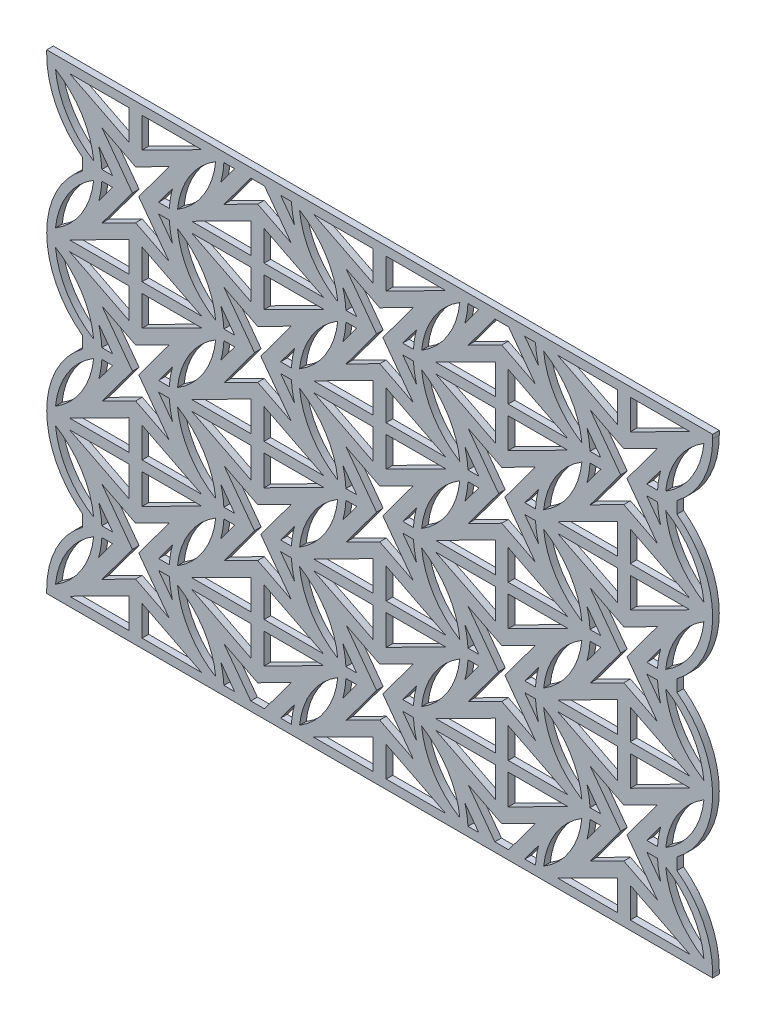
from build123d import *

# Parameters (mm, degrees)
BOSS_EXTRUDE2_DEPTH = 1.2


with BuildPart() as part:
    # Sketch1 → Boss-Extrude2 (new body)
    with BuildSketch(Plane.XY):
        with BuildLine():
            Line((-17.282218506, -13.133720362), (-17.282218506, -13.850172014))
            Line((-17.282218506, -13.850172014), (14.917781494, -13.850172014))
            Line((14.917781494, -13.850172014), (26.932678434, -13.850172014))
            Line((26.932678434, -13.850172014), (59.132678434, -13.850172014))
            Line((59.132678434, -13.850172014), (71.147575375, -13.850172014))
            Line((71.147575375, -13.850172014), (103.347575375, -13.850172014))
            Line((103.347575375, -13.850172014), (103.347575375, -13.133720362))
            ThreePointArc((103.347575375, -13.133720362), (101.64184858, -5.921584832), (96.88609725, -0.237639715))
            Line((96.88609725, -0.237639715), (96.88609725, 1.922478065))
            ThreePointArc((96.88609725, 1.922478065), (101.64184858, 7.606423182), (103.347575375, 14.818558712))
            ThreePointArc((103.347575375, 14.818558712), (101.64184858, 22.030694242), (96.88609725, 27.714639359))
            Line((96.88609725, 27.714639359), (96.88609725, 29.874757139))
            ThreePointArc((96.88609725, 29.874757139), (101.64184858, 35.558702256), (103.347575375, 42.770837786))
            ThreePointArc((103.347575375, 42.770837786), (101.64184858, 49.982973316), (96.88609725, 55.666918433))
            Line((96.88609725, 55.666918433), (96.88609725, 57.827036212))
            ThreePointArc((96.88609725, 57.827036212), (101.64184858, 63.51098133), (103.347575375, 70.723116859))
            Line((103.347575375, 70.723116859), (103.347575375, 71.439568512))
            Line((103.347575375, 71.439568512), (71.147575375, 71.439568512))
            Line((71.147575375, 71.439568512), (59.132678434, 71.439568512))
            Line((59.132678434, 71.439568512), (26.932678434, 71.439568512))
            Line((26.932678434, 71.439568512), (14.917781494, 71.439568512))
            Line((14.917781494, 71.439568512), (-17.282218506, 71.439568512))
            Line((-17.282218506, 71.439568512), (-17.282218506, 70.723116859))
            ThreePointArc((-17.282218506, 70.723116859), (-15.576491711, 63.51098133), (-10.820740382, 57.827036212))
            Line((-10.820740382, 57.827036212), (-10.820740382, 55.666918433))
            ThreePointArc((-10.820740382, 55.666918433), (-15.576491711, 49.982973316), (-17.282218506, 42.770837786))
            ThreePointArc((-17.282218506, 42.770837786), (-15.576491711, 35.558702256), (-10.820740382, 29.874757139))
            Line((-10.820740382, 29.874757139), (-10.820740382, 27.714639359))
            ThreePointArc((-10.820740382, 27.714639359), (-15.576491711, 22.030694242), (-17.282218506, 14.818558712))
            ThreePointArc((-17.282218506, 14.818558712), (-15.576491711, 7.606423182), (-10.820740382, 1.922478065))
            Line((-10.820740382, 1.922478065), (-10.820740382, -0.237639715))
            ThreePointArc((-10.820740382, -0.237639715), (-15.576491711, -5.921584832), (-17.282218506, -13.133720362))
        make_face()
        with BuildLine():
            Line((2.983915583, -0.076112846), (4.93282341, -0.076112846))
            ThreePointArc((4.93282341, -0.076112846), (5.124211725, -1.789802525), (5.498694363, -3.47299133))
            Line((5.498694363, -3.47299133), (2.983915583, -0.076112846))
        make_face(mode=Mode.SUBTRACT)
        with BuildLine():
            Line((-5.348352595, -0.076112846), (-7.297260422, -0.076112846))
            ThreePointArc((-7.297260422, -0.076112846), (-7.488648737, -1.789802525), (-7.863131375, -3.47299133))
            Line((-7.863131375, -3.47299133), (-5.348352595, -0.076112846))
        make_face(mode=Mode.SUBTRACT)
        with BuildLine():
            Line((-5.348352595, 1.760951197), (-7.863131375, 5.15782968))
            ThreePointArc((-7.863131375, 5.15782968), (-7.488648737, 3.474640875), (-7.297260422, 1.760951197))
            Line((-7.297260422, 1.760951197), (-5.348352595, 1.760951197))
        make_face(mode=Mode.SUBTRACT)
        Polygon((10.781824584, 13.90002669), (-0.008778726, 13.90002669), (-0.008778726, 8.450081975), align=None, mode=Mode.SUBTRACT)
        with BuildLine():
            Line((2.983915583, 1.760951197), (5.498694363, 5.15782968))
            ThreePointArc((5.498694363, 5.15782968), (5.124211725, 3.474640875), (4.93282341, 1.760951197))
            Line((4.93282341, 1.760951197), (2.983915583, 1.760951197))
        make_face(mode=Mode.SUBTRACT)
        Polygon((-2.355658286, 8.450081975), (-13.146261597, 13.90002669), (-2.355658286, 13.90002669), align=None, mode=Mode.SUBTRACT)
        Polygon((-1.182218506, -3.543353993), (4.907916872, -6.619261814), (-0.616118535, 0.842419175), (4.907916872, 8.304100164), (-1.182218506, 5.228192343), (-7.272353885, 8.304100164), (-1.748318477, 0.842419175), (-7.272353885, -6.619261814), align=None, mode=Mode.SUBTRACT)
        Polygon((-0.008778726, -12.21518834), (-0.008778726, -6.765243625), (10.781824584, -12.21518834), align=None, mode=Mode.SUBTRACT)
        Polygon((-2.355658286, -12.21518834), (-2.355658286, -6.765243625), (-13.146261597, -12.21518834), align=None, mode=Mode.SUBTRACT)
        Polygon((32.889273055, 27.876166227), (22.098669744, 27.876166227), (22.098669744, 22.426221512), align=None, mode=Mode.SUBTRACT)
        Polygon((32.889273055, 1.760951197), (22.098669744, 1.760951197), (22.098669744, 7.210895912), align=None, mode=Mode.SUBTRACT)
        Polygon((19.751790184, 27.876166227), (8.961186874, 27.876166227), (19.751790184, 22.426221512), align=None, mode=Mode.SUBTRACT)
        with BuildLine():
            Line((16.759095875, 13.90002669), (14.244317095, 10.503148207))
            ThreePointArc((14.244317095, 10.503148207), (14.618799733, 12.186337012), (14.810188048, 13.90002669))
            Line((14.810188048, 13.90002669), (16.759095875, 13.90002669))
        make_face(mode=Mode.SUBTRACT)
        with BuildLine():
            Line((16.759095875, 15.737090733), (14.810188048, 15.737090733))
            ThreePointArc((14.810188048, 15.737090733), (14.618799733, 17.450780412), (14.244317095, 19.133969217))
            Line((14.244317095, 19.133969217), (16.759095875, 15.737090733))
        make_face(mode=Mode.SUBTRACT)
        Polygon((19.751790184, 1.760951197), (8.961186874, 1.760951197), (19.751790184, 7.210895912), align=None, mode=Mode.SUBTRACT)
        Polygon((20.925229964, 19.20433188), (27.015365342, 22.280239701), (21.491329935, 14.818558712), (27.015365342, 7.356877723), (20.925229964, 10.432785544), (14.835094586, 7.356877723), (20.359129993, 14.818558712), (14.835094586, 22.280239701), align=None, mode=Mode.SUBTRACT)
        with BuildLine():
            Line((25.091364053, 15.737090733), (27.04027188, 15.737090733))
            ThreePointArc((27.04027188, 15.737090733), (27.231660195, 17.450780412), (27.606142833, 19.133969217))
            Line((27.606142833, 19.133969217), (25.091364053, 15.737090733))
        make_face(mode=Mode.SUBTRACT)
        with BuildLine():
            Line((25.091364053, 13.90002669), (27.606142833, 10.503148207))
            ThreePointArc((27.606142833, 10.503148207), (27.231660195, 12.186337012), (27.04027188, 13.90002669))
            Line((27.04027188, 13.90002669), (25.091364053, 13.90002669))
        make_face(mode=Mode.SUBTRACT)
        Polygon((54.996721525, 41.852305764), (44.206118214, 41.852305764), (44.206118214, 36.402361049), align=None, mode=Mode.SUBTRACT)
        Polygon((54.996721525, 15.737090733), (44.206118214, 15.737090733), (44.206118214, 21.187035449), align=None, mode=Mode.SUBTRACT)
        Polygon((41.859238654, 41.852305764), (31.068635344, 41.852305764), (41.859238654, 36.402361049), align=None, mode=Mode.SUBTRACT)
        with BuildLine():
            Line((38.866544345, 27.876166227), (36.351765565, 24.479287744))
            ThreePointArc((36.351765565, 24.479287744), (36.726248203, 26.162476549), (36.917636519, 27.876166227))
            Line((36.917636519, 27.876166227), (38.866544345, 27.876166227))
        make_face(mode=Mode.SUBTRACT)
        with BuildLine():
            Line((38.866544345, 29.71323027), (36.917636519, 29.71323027))
            ThreePointArc((36.917636519, 29.71323027), (36.726248203, 31.426919948), (36.351765565, 33.110108754))
            Line((36.351765565, 33.110108754), (38.866544345, 29.71323027))
        make_face(mode=Mode.SUBTRACT)
        Polygon((41.859238654, 15.737090733), (31.068635344, 15.737090733), (41.859238654, 21.187035449), align=None, mode=Mode.SUBTRACT)
        Polygon((43.032678434, 33.180471417), (49.122813813, 36.256379238), (43.598778405, 28.794698249), (49.122813813, 21.333017259), (43.032678434, 24.408925081), (36.942543056, 21.333017259), (42.466578463, 28.794698249), (36.942543056, 36.256379238), align=None, mode=Mode.SUBTRACT)
        with BuildLine():
            Line((47.198812523, 29.71323027), (49.14772035, 29.71323027))
            ThreePointArc((49.14772035, 29.71323027), (49.339108665, 31.426919948), (49.713591303, 33.110108754))
            Line((49.713591303, 33.110108754), (47.198812523, 29.71323027))
        make_face(mode=Mode.SUBTRACT)
        with BuildLine():
            Line((47.198812523, 27.876166227), (49.713591303, 24.479287744))
            ThreePointArc((49.713591303, 24.479287744), (49.339108665, 26.162476549), (49.14772035, 27.876166227))
            Line((49.14772035, 27.876166227), (47.198812523, 27.876166227))
        make_face(mode=Mode.SUBTRACT)
        Polygon((77.104169995, 55.828445301), (66.313566685, 55.828445301), (66.313566685, 50.378500585), align=None, mode=Mode.SUBTRACT)
        Polygon((77.104169995, 29.71323027), (66.313566685, 29.71323027), (66.313566685, 35.163174986), align=None, mode=Mode.SUBTRACT)
        Polygon((63.966687125, 55.828445301), (53.176083814, 55.828445301), (63.966687125, 50.378500585), align=None, mode=Mode.SUBTRACT)
        with BuildLine():
            Line((60.973992816, 41.852305764), (58.459214035, 38.455427281))
            ThreePointArc((58.459214035, 38.455427281), (58.833696674, 40.138616086), (59.025084989, 41.852305764))
            Line((59.025084989, 41.852305764), (60.973992816, 41.852305764))
        make_face(mode=Mode.SUBTRACT)
        with BuildLine():
            Line((60.973992816, 43.689369807), (59.025084989, 43.689369807))
            ThreePointArc((59.025084989, 43.689369807), (58.833696674, 45.403059485), (58.459214035, 47.08624829))
            Line((58.459214035, 47.08624829), (60.973992816, 43.689369807))
        make_face(mode=Mode.SUBTRACT)
        Polygon((63.966687125, 29.71323027), (53.176083814, 29.71323027), (63.966687125, 35.163174986), align=None, mode=Mode.SUBTRACT)
        Polygon((65.140126905, 47.156610953), (71.230262283, 50.232518775), (65.706226876, 42.770837786), (71.230262283, 35.309156796), (65.140126905, 38.385064618), (59.049991526, 35.309156796), (64.574026933, 42.770837786), (59.049991526, 50.232518775), align=None, mode=Mode.SUBTRACT)
        with BuildLine():
            Line((69.306260993, 43.689369807), (71.25516882, 43.689369807))
            ThreePointArc((71.25516882, 43.689369807), (71.446557135, 45.403059485), (71.821039774, 47.08624829))
            Line((71.821039774, 47.08624829), (69.306260993, 43.689369807))
        make_face(mode=Mode.SUBTRACT)
        with BuildLine():
            Line((69.306260993, 41.852305764), (71.821039774, 38.455427281))
            ThreePointArc((71.821039774, 38.455427281), (71.446557135, 40.138616086), (71.25516882, 41.852305764))
            Line((71.25516882, 41.852305764), (69.306260993, 41.852305764))
        make_face(mode=Mode.SUBTRACT)
        Polygon((99.211618465, 69.804584838), (88.421015155, 69.804584838), (88.421015155, 64.354640122), align=None, mode=Mode.SUBTRACT)
        Polygon((99.211618465, 43.689369807), (88.421015155, 43.689369807), (88.421015155, 49.139314523), align=None, mode=Mode.SUBTRACT)
        Polygon((86.074135595, 69.804584838), (75.283532284, 69.804584838), (86.074135595, 64.354640122), align=None, mode=Mode.SUBTRACT)
        with BuildLine():
            Line((83.081441286, 55.828445301), (80.566662506, 52.431566818))
            ThreePointArc((80.566662506, 52.431566818), (80.941145144, 54.114755623), (81.132533459, 55.828445301))
            Line((81.132533459, 55.828445301), (83.081441286, 55.828445301))
        make_face(mode=Mode.SUBTRACT)
        with BuildLine():
            Line((83.081441286, 57.665509344), (81.132533459, 57.665509344))
            ThreePointArc((81.132533459, 57.665509344), (80.941145144, 59.379199022), (80.566662506, 61.062387827))
            Line((80.566662506, 61.062387827), (83.081441286, 57.665509344))
        make_face(mode=Mode.SUBTRACT)
        Polygon((86.074135595, 43.689369807), (75.283532284, 43.689369807), (86.074135595, 49.139314523), align=None, mode=Mode.SUBTRACT)
        Polygon((87.247575375, 61.13275049), (93.337710753, 64.208658312), (87.813675346, 56.746977323), (93.337710753, 49.285296333), (87.247575375, 52.361204155), (81.157439996, 49.285296333), (86.681475404, 56.746977323), (81.157439996, 64.208658312), align=None, mode=Mode.SUBTRACT)
        with BuildLine():
            Line((91.413709464, 57.665509344), (93.362617291, 57.665509344))
            ThreePointArc((93.362617291, 57.665509344), (93.554005606, 59.379199022), (93.928488244, 61.062387827))
            Line((93.928488244, 61.062387827), (91.413709464, 57.665509344))
        make_face(mode=Mode.SUBTRACT)
        with BuildLine():
            Line((91.413709464, 55.828445301), (93.928488244, 52.431566818))
            ThreePointArc((93.928488244, 52.431566818), (93.554005606, 54.114755623), (93.362617291, 55.828445301))
            Line((93.362617291, 55.828445301), (91.413709464, 55.828445301))
        make_face(mode=Mode.SUBTRACT)
        Polygon((20.925229964, 47.156610953), (27.015365342, 50.232518775), (21.491329935, 42.770837786), (27.015365342, 35.309156796), (20.925229964, 38.385064618), (14.835094586, 35.309156796), (20.359129993, 42.770837786), (14.835094586, 50.232518775), align=None, mode=Mode.SUBTRACT)
        with BuildLine():
            Line((16.759095875, 41.852305764), (14.244317095, 38.455427281))
            ThreePointArc((14.244317095, 38.455427281), (14.618799733, 40.138616086), (14.810188048, 41.852305764))
            Line((14.810188048, 41.852305764), (16.759095875, 41.852305764))
        make_face(mode=Mode.SUBTRACT)
        with BuildLine():
            Line((25.091364053, 41.852305764), (27.04027188, 41.852305764))
            ThreePointArc((27.04027188, 41.852305764), (27.231660195, 40.138616086), (27.606142833, 38.455427281))
            Line((27.606142833, 38.455427281), (25.091364053, 41.852305764))
        make_face(mode=Mode.SUBTRACT)
        Polygon((19.751790184, 50.378500585), (8.961186874, 55.828445301), (19.751790184, 55.828445301), align=None, mode=Mode.SUBTRACT)
        with BuildLine():
            Line((16.759095875, 43.689369807), (14.244317095, 47.08624829))
            ThreePointArc((14.244317095, 47.08624829), (14.618799733, 45.403059485), (14.810188048, 43.689369807))
            Line((14.810188048, 43.689369807), (16.759095875, 43.689369807))
        make_face(mode=Mode.SUBTRACT)
        Polygon((22.098669744, 29.71323027), (22.098669744, 35.163174986), (32.889273055, 29.71323027), align=None, mode=Mode.SUBTRACT)
        Polygon((22.098669744, 50.378500585), (32.889273055, 55.828445301), (22.098669744, 55.828445301), align=None, mode=Mode.SUBTRACT)
        Polygon((19.751790184, 35.163174986), (8.961186874, 29.71323027), (19.751790184, 29.71323027), align=None, mode=Mode.SUBTRACT)
        with BuildLine():
            Line((25.091364053, 43.689369807), (27.04027188, 43.689369807))
            ThreePointArc((27.04027188, 43.689369807), (27.231660195, 45.403059485), (27.606142833, 47.08624829))
            Line((27.606142833, 47.08624829), (25.091364053, 43.689369807))
        make_face(mode=Mode.SUBTRACT)
        Polygon((43.032678434, 61.13275049), (49.122813813, 64.208658312), (43.598778405, 56.746977323), (49.122813813, 49.285296333), (43.032678434, 52.361204155), (36.942543056, 49.285296333), (42.466578463, 56.746977323), (36.942543056, 64.208658312), align=None, mode=Mode.SUBTRACT)
        with BuildLine():
            Line((38.866544345, 55.828445301), (36.351765565, 52.431566818))
            ThreePointArc((36.351765565, 52.431566818), (36.726248203, 54.114755623), (36.917636519, 55.828445301))
            Line((36.917636519, 55.828445301), (38.866544345, 55.828445301))
        make_face(mode=Mode.SUBTRACT)
        with BuildLine():
            Line((47.198812523, 55.828445301), (49.14772035, 55.828445301))
            ThreePointArc((49.14772035, 55.828445301), (49.339108665, 54.114755623), (49.713591303, 52.431566818))
            Line((49.713591303, 52.431566818), (47.198812523, 55.828445301))
        make_face(mode=Mode.SUBTRACT)
        Polygon((41.859238654, 64.354640122), (31.068635344, 69.804584838), (41.859238654, 69.804584838), align=None, mode=Mode.SUBTRACT)
        with BuildLine():
            Line((38.866544345, 57.665509344), (36.351765565, 61.062387827))
            ThreePointArc((36.351765565, 61.062387827), (36.726248203, 59.379199022), (36.917636519, 57.665509344))
            Line((36.917636519, 57.665509344), (38.866544345, 57.665509344))
        make_face(mode=Mode.SUBTRACT)
        Polygon((44.206118214, 43.689369807), (44.206118214, 49.139314523), (54.996721525, 43.689369807), align=None, mode=Mode.SUBTRACT)
        Polygon((44.206118214, 64.354640122), (54.996721525, 69.804584838), (44.206118214, 69.804584838), align=None, mode=Mode.SUBTRACT)
        Polygon((41.859238654, 49.139314523), (31.068635344, 43.689369807), (41.859238654, 43.689369807), align=None, mode=Mode.SUBTRACT)
        with BuildLine():
            Line((47.198812523, 57.665509344), (49.14772035, 57.665509344))
            ThreePointArc((49.14772035, 57.665509344), (49.339108665, 59.379199022), (49.713591303, 61.062387827))
            Line((49.713591303, 61.062387827), (47.198812523, 57.665509344))
        make_face(mode=Mode.SUBTRACT)
        Polygon((-1.182218506, 33.180471417), (4.907916872, 36.256379238), (-0.616118535, 28.794698249), (4.907916872, 21.333017259), (-1.182218506, 24.408925081), (-7.272353885, 21.333017259), (-1.748318477, 28.794698249), (-7.272353885, 36.256379238), align=None, mode=Mode.SUBTRACT)
        with BuildLine():
            Line((-5.348352595, 27.876166227), (-7.863131375, 24.479287744))
            ThreePointArc((-7.863131375, 24.479287744), (-7.488648737, 26.162476549), (-7.297260422, 27.876166227))
            Line((-7.297260422, 27.876166227), (-5.348352595, 27.876166227))
        make_face(mode=Mode.SUBTRACT)
        with BuildLine():
            Line((2.983915583, 27.876166227), (4.93282341, 27.876166227))
            ThreePointArc((4.93282341, 27.876166227), (5.124211725, 26.162476549), (5.498694363, 24.479287744))
            Line((5.498694363, 24.479287744), (2.983915583, 27.876166227))
        make_face(mode=Mode.SUBTRACT)
        Polygon((-2.355658286, 36.402361049), (-13.146261597, 41.852305764), (-2.355658286, 41.852305764), align=None, mode=Mode.SUBTRACT)
        with BuildLine():
            Line((-5.348352595, 29.71323027), (-7.863131375, 33.110108754))
            ThreePointArc((-7.863131375, 33.110108754), (-7.488648737, 31.426919948), (-7.297260422, 29.71323027))
            Line((-7.297260422, 29.71323027), (-5.348352595, 29.71323027))
        make_face(mode=Mode.SUBTRACT)
        Polygon((-0.008778726, 15.737090733), (-0.008778726, 21.187035449), (10.781824584, 15.737090733), align=None, mode=Mode.SUBTRACT)
        Polygon((-0.008778726, 36.402361049), (10.781824584, 41.852305764), (-0.008778726, 41.852305764), align=None, mode=Mode.SUBTRACT)
        Polygon((-2.355658286, 21.187035449), (-13.146261597, 15.737090733), (-2.355658286, 15.737090733), align=None, mode=Mode.SUBTRACT)
        with BuildLine():
            Line((2.983915583, 29.71323027), (4.93282341, 29.71323027))
            ThreePointArc((4.93282341, 29.71323027), (5.124211725, 31.426919948), (5.498694363, 33.110108754))
            Line((5.498694363, 33.110108754), (2.983915583, 29.71323027))
        make_face(mode=Mode.SUBTRACT)
        with BuildLine():
            Line((60.973992816, 69.804584838), (58.459214035, 66.407706355))
            ThreePointArc((58.459214035, 66.407706355), (58.833696674, 68.09089516), (59.025084989, 69.804584838))
            Line((59.025084989, 69.804584838), (60.973992816, 69.804584838))
        make_face(mode=Mode.SUBTRACT)
        with BuildLine():
            Line((69.306260993, 69.804584838), (71.25516882, 69.804584838))
            ThreePointArc((71.25516882, 69.804584838), (71.446557135, 68.09089516), (71.821039774, 66.407706355))
            Line((71.821039774, 66.407706355), (69.306260993, 69.804584838))
        make_face(mode=Mode.SUBTRACT)
        Polygon((65.140126905, 66.337343692), (71.230262283, 63.26143587), (66.386234962, 69.804584838), (63.894018847, 69.804584838), (59.049991526, 63.26143587), align=None, mode=Mode.SUBTRACT)
        Polygon((66.313566685, 57.665509344), (66.313566685, 63.11545406), (77.104169995, 57.665509344), align=None, mode=Mode.SUBTRACT)
        Polygon((63.966687125, 63.11545406), (53.176083814, 57.665509344), (63.966687125, 57.665509344), align=None, mode=Mode.SUBTRACT)
        with BuildLine():
            Line((16.759095875, 69.804584838), (14.244317095, 66.407706355))
            ThreePointArc((14.244317095, 66.407706355), (14.618799733, 68.09089516), (14.810188048, 69.804584838))
            Line((14.810188048, 69.804584838), (16.759095875, 69.804584838))
        make_face(mode=Mode.SUBTRACT)
        with BuildLine():
            Line((25.091364053, 69.804584838), (27.04027188, 69.804584838))
            ThreePointArc((27.04027188, 69.804584838), (27.231660195, 68.09089516), (27.606142833, 66.407706355))
            Line((27.606142833, 66.407706355), (25.091364053, 69.804584838))
        make_face(mode=Mode.SUBTRACT)
        Polygon((20.925229964, 66.337343692), (27.015365342, 63.26143587), (22.171338021, 69.804584838), (19.679121907, 69.804584838), (14.835094586, 63.26143587), align=None, mode=Mode.SUBTRACT)
        Polygon((22.098669744, 57.665509344), (22.098669744, 63.11545406), (32.889273055, 57.665509344), align=None, mode=Mode.SUBTRACT)
        Polygon((19.751790184, 63.11545406), (8.961186874, 57.665509344), (19.751790184, 57.665509344), align=None, mode=Mode.SUBTRACT)
        Polygon((-1.182218506, 61.13275049), (4.907916872, 64.208658312), (-0.616118535, 56.746977323), (4.907916872, 49.285296333), (-1.182218506, 52.361204155), (-7.272353885, 49.285296333), (-1.748318477, 56.746977323), (-7.272353885, 64.208658312), align=None, mode=Mode.SUBTRACT)
        with BuildLine():
            Line((-5.348352595, 55.828445301), (-7.863131375, 52.431566818))
            ThreePointArc((-7.863131375, 52.431566818), (-7.488648737, 54.114755623), (-7.297260422, 55.828445301))
            Line((-7.297260422, 55.828445301), (-5.348352595, 55.828445301))
        make_face(mode=Mode.SUBTRACT)
        with BuildLine():
            Line((2.983915583, 55.828445301), (4.93282341, 55.828445301))
            ThreePointArc((4.93282341, 55.828445301), (5.124211725, 54.114755623), (5.498694363, 52.431566818))
            Line((5.498694363, 52.431566818), (2.983915583, 55.828445301))
        make_face(mode=Mode.SUBTRACT)
        Polygon((-2.355658286, 64.354640122), (-13.146261597, 69.804584838), (-2.355658286, 69.804584838), align=None, mode=Mode.SUBTRACT)
        with BuildLine():
            Line((-5.348352595, 57.665509344), (-7.863131375, 61.062387827))
            ThreePointArc((-7.863131375, 61.062387827), (-7.488648737, 59.379199022), (-7.297260422, 57.665509344))
            Line((-7.297260422, 57.665509344), (-5.348352595, 57.665509344))
        make_face(mode=Mode.SUBTRACT)
        Polygon((-0.008778726, 43.689369807), (-0.008778726, 49.139314523), (10.781824584, 43.689369807), align=None, mode=Mode.SUBTRACT)
        Polygon((-0.008778726, 64.354640122), (10.781824584, 69.804584838), (-0.008778726, 69.804584838), align=None, mode=Mode.SUBTRACT)
        Polygon((-2.355658286, 49.139314523), (-13.146261597, 43.689369807), (-2.355658286, 43.689369807), align=None, mode=Mode.SUBTRACT)
        with BuildLine():
            Line((2.983915583, 57.665509344), (4.93282341, 57.665509344))
            ThreePointArc((4.93282341, 57.665509344), (5.124211725, 59.379199022), (5.498694363, 61.062387827))
            Line((5.498694363, 61.062387827), (2.983915583, 57.665509344))
        make_face(mode=Mode.SUBTRACT)
        with BuildLine():
            Line((47.198812523, 1.760951197), (49.713591303, 5.15782968))
            ThreePointArc((49.713591303, 5.15782968), (49.339108665, 3.474640875), (49.14772035, 1.760951197))
            Line((49.14772035, 1.760951197), (47.198812523, 1.760951197))
        make_face(mode=Mode.SUBTRACT)
        Polygon((54.996721525, -12.21518834), (44.206118214, -12.21518834), (44.206118214, -6.765243625), align=None, mode=Mode.SUBTRACT)
        Polygon((44.206118214, 13.90002669), (44.206118214, 8.450081975), (54.996721525, 13.90002669), align=None, mode=Mode.SUBTRACT)
        Polygon((41.859238654, -12.21518834), (41.859238654, -6.765243625), (31.068635344, -12.21518834), align=None, mode=Mode.SUBTRACT)
        Polygon((49.122813813, 8.304100164), (43.598778405, 0.842419175), (49.122813813, -6.619261814), (43.032678434, -3.543353993), (36.942543056, -6.619261814), (42.466578463, 0.842419175), (36.942543056, 8.304100164), (43.032678434, 5.228192343), align=None, mode=Mode.SUBTRACT)
        Polygon((41.859238654, 13.90002669), (41.859238654, 8.450081975), (31.068635344, 13.90002669), align=None, mode=Mode.SUBTRACT)
        with BuildLine():
            Line((38.866544345, -0.076112846), (36.917636519, -0.076112846))
            ThreePointArc((36.917636519, -0.076112846), (36.726248203, -1.789802525), (36.351765565, -3.47299133))
            Line((36.351765565, -3.47299133), (38.866544345, -0.076112846))
        make_face(mode=Mode.SUBTRACT)
        with BuildLine():
            Line((47.198812523, -0.076112846), (49.713591303, -3.47299133))
            ThreePointArc((49.713591303, -3.47299133), (49.339108665, -1.789802525), (49.14772035, -0.076112846))
            Line((49.14772035, -0.076112846), (47.198812523, -0.076112846))
        make_face(mode=Mode.SUBTRACT)
        with BuildLine():
            Line((38.866544345, 1.760951197), (36.351765565, 5.15782968))
            ThreePointArc((36.351765565, 5.15782968), (36.726248203, 3.474640875), (36.917636519, 1.760951197))
            Line((36.917636519, 1.760951197), (38.866544345, 1.760951197))
        make_face(mode=Mode.SUBTRACT)
        with BuildLine():
            Line((69.306260993, 15.737090733), (71.821039774, 19.133969217))
            ThreePointArc((71.821039774, 19.133969217), (71.446557135, 17.450780412), (71.25516882, 15.737090733))
            Line((71.25516882, 15.737090733), (69.306260993, 15.737090733))
        make_face(mode=Mode.SUBTRACT)
        Polygon((77.104169995, 1.760951197), (66.313566685, 1.760951197), (66.313566685, 7.210895912), align=None, mode=Mode.SUBTRACT)
        Polygon((66.313566685, 27.876166227), (66.313566685, 22.426221512), (77.104169995, 27.876166227), align=None, mode=Mode.SUBTRACT)
        Polygon((63.966687125, 1.760951197), (63.966687125, 7.210895912), (53.176083814, 1.760951197), align=None, mode=Mode.SUBTRACT)
        Polygon((71.230262283, 22.280239701), (65.706226876, 14.818558712), (71.230262283, 7.356877723), (65.140126905, 10.432785544), (59.049991526, 7.356877723), (64.574026933, 14.818558712), (59.049991526, 22.280239701), (65.140126905, 19.20433188), align=None, mode=Mode.SUBTRACT)
        Polygon((63.966687125, 27.876166227), (63.966687125, 22.426221512), (53.176083814, 27.876166227), align=None, mode=Mode.SUBTRACT)
        with BuildLine():
            Line((60.973992816, 13.90002669), (59.025084989, 13.90002669))
            ThreePointArc((59.025084989, 13.90002669), (58.833696674, 12.186337012), (58.459214035, 10.503148207))
            Line((58.459214035, 10.503148207), (60.973992816, 13.90002669))
        make_face(mode=Mode.SUBTRACT)
        with BuildLine():
            Line((69.306260993, 13.90002669), (71.821039774, 10.503148207))
            ThreePointArc((71.821039774, 10.503148207), (71.446557135, 12.186337012), (71.25516882, 13.90002669))
            Line((71.25516882, 13.90002669), (69.306260993, 13.90002669))
        make_face(mode=Mode.SUBTRACT)
        with BuildLine():
            Line((60.973992816, 15.737090733), (58.459214035, 19.133969217))
            ThreePointArc((58.459214035, 19.133969217), (58.833696674, 17.450780412), (59.025084989, 15.737090733))
            Line((59.025084989, 15.737090733), (60.973992816, 15.737090733))
        make_face(mode=Mode.SUBTRACT)
        with BuildLine():
            Line((91.413709464, 29.71323027), (93.928488244, 33.110108754))
            ThreePointArc((93.928488244, 33.110108754), (93.554005606, 31.426919948), (93.362617291, 29.71323027))
            Line((93.362617291, 29.71323027), (91.413709464, 29.71323027))
        make_face(mode=Mode.SUBTRACT)
        Polygon((99.211618465, 15.737090733), (88.421015155, 15.737090733), (88.421015155, 21.187035449), align=None, mode=Mode.SUBTRACT)
        Polygon((88.421015155, 41.852305764), (88.421015155, 36.402361049), (99.211618465, 41.852305764), align=None, mode=Mode.SUBTRACT)
        Polygon((86.074135595, 15.737090733), (86.074135595, 21.187035449), (75.283532284, 15.737090733), align=None, mode=Mode.SUBTRACT)
        Polygon((93.337710753, 36.256379238), (87.813675346, 28.794698249), (93.337710753, 21.333017259), (87.247575375, 24.408925081), (81.157439996, 21.333017259), (86.681475404, 28.794698249), (81.157439996, 36.256379238), (87.247575375, 33.180471417), align=None, mode=Mode.SUBTRACT)
        Polygon((86.074135595, 41.852305764), (86.074135595, 36.402361049), (75.283532284, 41.852305764), align=None, mode=Mode.SUBTRACT)
        with BuildLine():
            Line((83.081441286, 27.876166227), (81.132533459, 27.876166227))
            ThreePointArc((81.132533459, 27.876166227), (80.941145144, 26.162476549), (80.566662506, 24.479287744))
            Line((80.566662506, 24.479287744), (83.081441286, 27.876166227))
        make_face(mode=Mode.SUBTRACT)
        with BuildLine():
            Line((91.413709464, 27.876166227), (93.928488244, 24.479287744))
            ThreePointArc((93.928488244, 24.479287744), (93.554005606, 26.162476549), (93.362617291, 27.876166227))
            Line((93.362617291, 27.876166227), (91.413709464, 27.876166227))
        make_face(mode=Mode.SUBTRACT)
        with BuildLine():
            Line((83.081441286, 29.71323027), (80.566662506, 33.110108754))
            ThreePointArc((80.566662506, 33.110108754), (80.941145144, 31.426919948), (81.132533459, 29.71323027))
            Line((81.132533459, 29.71323027), (83.081441286, 29.71323027))
        make_face(mode=Mode.SUBTRACT)
        with BuildLine():
            Line((83.081441286, 1.760951197), (80.566662506, 5.15782968))
            ThreePointArc((80.566662506, 5.15782968), (80.941145144, 3.474640875), (81.132533459, 1.760951197))
            Line((81.132533459, 1.760951197), (83.081441286, 1.760951197))
        make_face(mode=Mode.SUBTRACT)
        Polygon((87.247575375, -3.543353993), (81.157439996, -6.619261814), (86.681475404, 0.842419175), (81.157439996, 8.304100164), (87.247575375, 5.228192343), (93.337710753, 8.304100164), (87.813675346, 0.842419175), (93.337710753, -6.619261814), align=None, mode=Mode.SUBTRACT)
        Polygon((86.074135595, 8.450081975), (75.283532284, 13.90002669), (86.074135595, 13.90002669), align=None, mode=Mode.SUBTRACT)
        Polygon((88.421015155, 13.90002669), (88.421015155, 8.450081975), (99.211618465, 13.90002669), align=None, mode=Mode.SUBTRACT)
        with BuildLine():
            Line((91.413709464, -0.076112846), (93.928488244, -3.47299133))
            ThreePointArc((93.928488244, -3.47299133), (93.554005606, -1.789802525), (93.362617291, -0.076112846))
            Line((93.362617291, -0.076112846), (91.413709464, -0.076112846))
        make_face(mode=Mode.SUBTRACT)
        Polygon((88.421015155, -6.765243625), (99.211618465, -12.21518834), (88.421015155, -12.21518834), align=None, mode=Mode.SUBTRACT)
        Polygon((86.074135595, -6.765243625), (75.283532284, -12.21518834), (86.074135595, -12.21518834), align=None, mode=Mode.SUBTRACT)
        with BuildLine():
            Line((83.081441286, -0.076112846), (81.132533459, -0.076112846))
            ThreePointArc((81.132533459, -0.076112846), (80.941145144, -1.789802525), (80.566662506, -3.47299133))
            Line((80.566662506, -3.47299133), (83.081441286, -0.076112846))
        make_face(mode=Mode.SUBTRACT)
        with BuildLine():
            Line((91.413709464, 1.760951197), (93.928488244, 5.15782968))
            ThreePointArc((93.928488244, 5.15782968), (93.554005606, 3.474640875), (93.362617291, 1.760951197))
            Line((93.362617291, 1.760951197), (91.413709464, 1.760951197))
        make_face(mode=Mode.SUBTRACT)
        with BuildLine():
            Line((16.759095875, -12.21518834), (14.244317095, -8.818309857))
            ThreePointArc((14.244317095, -8.818309857), (14.618799733, -10.501498662), (14.810188048, -12.21518834))
            Line((14.810188048, -12.21518834), (16.759095875, -12.21518834))
        make_face(mode=Mode.SUBTRACT)
        Polygon((19.751790184, -5.526057562), (8.961186874, -0.076112846), (19.751790184, -0.076112846), align=None, mode=Mode.SUBTRACT)
        Polygon((22.098669744, -0.076112846), (22.098669744, -5.526057562), (32.889273055, -0.076112846), align=None, mode=Mode.SUBTRACT)
        Polygon((14.835094586, -5.672039373), (19.679121907, -12.21518834), (22.171338021, -12.21518834), (27.015365342, -5.672039373), (20.925229964, -8.747947194), align=None, mode=Mode.SUBTRACT)
        with BuildLine():
            Line((25.091364053, -12.21518834), (27.606142833, -8.818309857))
            ThreePointArc((27.606142833, -8.818309857), (27.231660195, -10.501498662), (27.04027188, -12.21518834))
            Line((27.04027188, -12.21518834), (25.091364053, -12.21518834))
        make_face(mode=Mode.SUBTRACT)
        with BuildLine():
            Line((60.973992816, -12.21518834), (58.459214035, -8.818309857))
            ThreePointArc((58.459214035, -8.818309857), (58.833696674, -10.501498662), (59.025084989, -12.21518834))
            Line((59.025084989, -12.21518834), (60.973992816, -12.21518834))
        make_face(mode=Mode.SUBTRACT)
        Polygon((63.966687125, -5.526057562), (53.176083814, -0.076112846), (63.966687125, -0.076112846), align=None, mode=Mode.SUBTRACT)
        Polygon((66.313566685, -0.076112846), (66.313566685, -5.526057562), (77.104169995, -0.076112846), align=None, mode=Mode.SUBTRACT)
        Polygon((59.049991526, -5.672039373), (63.894018847, -12.21518834), (66.386234962, -12.21518834), (71.230262283, -5.672039373), (65.140126905, -8.747947194), align=None, mode=Mode.SUBTRACT)
        with BuildLine():
            Line((69.306260993, -12.21518834), (71.821039774, -8.818309857))
            ThreePointArc((71.821039774, -8.818309857), (71.446557135, -10.501498662), (71.25516882, -12.21518834))
            Line((71.25516882, -12.21518834), (69.306260993, -12.21518834))
        make_face(mode=Mode.SUBTRACT)
        with BuildLine():
            ThreePointArc((6.412706169, -0.67452369), (11.151396092, -5.33651487), (13.330305289, -11.616777497))
            ThreePointArc((13.330305289, -11.616777497), (8.591615366, -6.954786317), (6.412706169, -0.67452369))
        make_face(mode=Mode.SUBTRACT)
        with BuildLine():
            ThreePointArc((-15.694742301, -11.616777497), (-10.956052378, -6.954786317), (-8.777143182, -0.67452369))
            ThreePointArc((-8.777143182, -0.67452369), (-13.515833105, -5.33651487), (-15.694742301, -11.616777497))
        make_face(mode=Mode.SUBTRACT)
        with BuildLine():
            ThreePointArc((6.412706169, 2.35936204), (11.151396092, 7.02135322), (13.330305289, 13.301615847))
            ThreePointArc((13.330305289, 13.301615847), (8.591615366, 8.639624667), (6.412706169, 2.35936204))
        make_face(mode=Mode.SUBTRACT)
        with BuildLine():
            ThreePointArc((-15.694742301, 13.301615847), (-10.956052378, 8.639624667), (-8.777143182, 2.35936204))
            ThreePointArc((-8.777143182, 2.35936204), (-13.515833105, 7.02135322), (-15.694742301, 13.301615847))
        make_face(mode=Mode.SUBTRACT)
        with BuildLine():
            ThreePointArc((35.437753759, 2.35936204), (30.699063836, 7.02135322), (28.52015464, 13.301615847))
            ThreePointArc((28.52015464, 13.301615847), (33.258844563, 8.639624667), (35.437753759, 2.35936204))
        make_face(mode=Mode.SUBTRACT)
        with BuildLine():
            ThreePointArc((35.437753759, 27.277755384), (30.699063836, 22.615764204), (28.52015464, 16.335501576))
            ThreePointArc((28.52015464, 16.335501576), (33.258844563, 20.997492757), (35.437753759, 27.277755384))
        make_face(mode=Mode.SUBTRACT)
        with BuildLine():
            ThreePointArc((57.545202229, 16.335501576), (52.806512306, 20.997492757), (50.62760311, 27.277755384))
            ThreePointArc((50.62760311, 27.277755384), (55.366293033, 22.615764204), (57.545202229, 16.335501576))
        make_face(mode=Mode.SUBTRACT)
        with BuildLine():
            ThreePointArc((57.545202229, 41.253894921), (52.806512306, 36.591903741), (50.62760311, 30.311641113))
            ThreePointArc((50.62760311, 30.311641113), (55.366293033, 34.973632294), (57.545202229, 41.253894921))
        make_face(mode=Mode.SUBTRACT)
        with BuildLine():
            ThreePointArc((79.652650699, 30.311641113), (74.913960776, 34.973632294), (72.73505158, 41.253894921))
            ThreePointArc((72.73505158, 41.253894921), (77.473741503, 36.591903741), (79.652650699, 30.311641113))
        make_face(mode=Mode.SUBTRACT)
        with BuildLine():
            ThreePointArc((79.652650699, 55.230034458), (74.913960776, 50.568043278), (72.73505158, 44.28778065))
            ThreePointArc((72.73505158, 44.28778065), (77.473741503, 48.949771831), (79.652650699, 55.230034458))
        make_face(mode=Mode.SUBTRACT)
        with BuildLine():
            ThreePointArc((101.760099169, 44.28778065), (97.021409246, 48.949771831), (94.84250005, 55.230034458))
            ThreePointArc((94.84250005, 55.230034458), (99.581189973, 50.568043278), (101.760099169, 44.28778065))
        make_face(mode=Mode.SUBTRACT)
        with BuildLine():
            ThreePointArc((101.760099169, 69.206173995), (97.021409246, 64.544182814), (94.84250005, 58.263920187))
            ThreePointArc((94.84250005, 58.263920187), (99.581189973, 62.925911368), (101.760099169, 69.206173995))
        make_face(mode=Mode.SUBTRACT)
        with BuildLine():
            ThreePointArc((28.52015464, 41.253894921), (33.258844563, 36.591903741), (35.437753759, 30.311641113))
            ThreePointArc((35.437753759, 30.311641113), (30.699063836, 34.973632294), (28.52015464, 41.253894921))
        make_face(mode=Mode.SUBTRACT)
        with BuildLine():
            ThreePointArc((35.437753759, 55.230034458), (30.699063836, 50.568043278), (28.52015464, 44.28778065))
            ThreePointArc((28.52015464, 44.28778065), (33.258844563, 48.949771831), (35.437753759, 55.230034458))
        make_face(mode=Mode.SUBTRACT)
        with BuildLine():
            ThreePointArc((50.62760311, 55.230034458), (55.366293033, 50.568043278), (57.545202229, 44.28778065))
            ThreePointArc((57.545202229, 44.28778065), (52.806512306, 48.949771831), (50.62760311, 55.230034458))
        make_face(mode=Mode.SUBTRACT)
        with BuildLine():
            ThreePointArc((57.545202229, 69.206173995), (52.806512306, 64.544182814), (50.62760311, 58.263920187))
            ThreePointArc((50.62760311, 58.263920187), (55.366293033, 62.925911368), (57.545202229, 69.206173995))
        make_face(mode=Mode.SUBTRACT)
        with BuildLine():
            ThreePointArc((6.412706169, 27.277755384), (11.151396092, 22.615764204), (13.330305289, 16.335501576))
            ThreePointArc((13.330305289, 16.335501576), (8.591615366, 20.997492757), (6.412706169, 27.277755384))
        make_face(mode=Mode.SUBTRACT)
        with BuildLine():
            ThreePointArc((-15.694742301, 41.253894921), (-10.956052378, 36.591903741), (-8.777143182, 30.311641113))
            ThreePointArc((-8.777143182, 30.311641113), (-13.515833105, 34.973632294), (-15.694742301, 41.253894921))
        make_face(mode=Mode.SUBTRACT)
        with BuildLine():
            ThreePointArc((13.330305289, 41.253894921), (8.591615366, 36.591903741), (6.412706169, 30.311641113))
            ThreePointArc((6.412706169, 30.311641113), (11.151396092, 34.973632294), (13.330305289, 41.253894921))
        make_face(mode=Mode.SUBTRACT)
        with BuildLine():
            ThreePointArc((-8.777143182, 27.277755384), (-13.515833105, 22.615764204), (-15.694742301, 16.335501576))
            ThreePointArc((-15.694742301, 16.335501576), (-10.956052378, 20.997492757), (-8.777143182, 27.277755384))
        make_face(mode=Mode.SUBTRACT)
        with BuildLine():
            ThreePointArc((72.73505158, 69.206173995), (77.473741503, 64.544182814), (79.652650699, 58.263920187))
            ThreePointArc((79.652650699, 58.263920187), (74.913960776, 62.925911368), (72.73505158, 69.206173995))
        make_face(mode=Mode.SUBTRACT)
        with BuildLine():
            ThreePointArc((28.52015464, 69.206173995), (33.258844563, 64.544182814), (35.437753759, 58.263920187))
            ThreePointArc((35.437753759, 58.263920187), (30.699063836, 62.925911368), (28.52015464, 69.206173995))
        make_face(mode=Mode.SUBTRACT)
        with BuildLine():
            ThreePointArc((6.412706169, 55.230034458), (11.151396092, 50.568043278), (13.330305289, 44.28778065))
            ThreePointArc((13.330305289, 44.28778065), (8.591615366, 48.949771831), (6.412706169, 55.230034458))
        make_face(mode=Mode.SUBTRACT)
        with BuildLine():
            ThreePointArc((-15.694742301, 69.206173995), (-10.956052378, 64.544182814), (-8.777143182, 58.263920187))
            ThreePointArc((-8.777143182, 58.263920187), (-13.515833105, 62.925911368), (-15.694742301, 69.206173995))
        make_face(mode=Mode.SUBTRACT)
        with BuildLine():
            ThreePointArc((13.330305289, 69.206173995), (8.591615366, 64.544182814), (6.412706169, 58.263920187))
            ThreePointArc((6.412706169, 58.263920187), (11.151396092, 62.925911368), (13.330305289, 69.206173995))
        make_face(mode=Mode.SUBTRACT)
        with BuildLine():
            ThreePointArc((-8.777143182, 55.230034458), (-13.515833105, 50.568043278), (-15.694742301, 44.28778065))
            ThreePointArc((-15.694742301, 44.28778065), (-10.956052378, 48.949771831), (-8.777143182, 55.230034458))
        make_face(mode=Mode.SUBTRACT)
        with BuildLine():
            ThreePointArc((50.62760311, -0.67452369), (55.366293033, -5.33651487), (57.545202229, -11.616777497))
            ThreePointArc((57.545202229, -11.616777497), (52.806512306, -6.954786317), (50.62760311, -0.67452369))
        make_face(mode=Mode.SUBTRACT)
        with BuildLine():
            ThreePointArc((57.545202229, 13.301615847), (52.806512306, 8.639624667), (50.62760311, 2.35936204))
            ThreePointArc((50.62760311, 2.35936204), (55.366293033, 7.02135322), (57.545202229, 13.301615847))
        make_face(mode=Mode.SUBTRACT)
        with BuildLine():
            ThreePointArc((72.73505158, 13.301615847), (77.473741503, 8.639624667), (79.652650699, 2.35936204))
            ThreePointArc((79.652650699, 2.35936204), (74.913960776, 7.02135322), (72.73505158, 13.301615847))
        make_face(mode=Mode.SUBTRACT)
        with BuildLine():
            ThreePointArc((79.652650699, 27.277755384), (74.913960776, 22.615764204), (72.73505158, 16.335501576))
            ThreePointArc((72.73505158, 16.335501576), (77.473741503, 20.997492757), (79.652650699, 27.277755384))
        make_face(mode=Mode.SUBTRACT)
        with BuildLine():
            ThreePointArc((94.84250005, 27.277755384), (99.581189973, 22.615764204), (101.760099169, 16.335501576))
            ThreePointArc((101.760099169, 16.335501576), (97.021409246, 20.997492757), (94.84250005, 27.277755384))
        make_face(mode=Mode.SUBTRACT)
        with BuildLine():
            ThreePointArc((101.760099169, 41.253894921), (97.021409246, 36.591903741), (94.84250005, 30.311641113))
            ThreePointArc((94.84250005, 30.311641113), (99.581189973, 34.973632294), (101.760099169, 41.253894921))
        make_face(mode=Mode.SUBTRACT)
        with BuildLine():
            ThreePointArc((101.760099169, -11.616777497), (97.021409246, -6.954786317), (94.84250005, -0.67452369))
            ThreePointArc((94.84250005, -0.67452369), (99.581189973, -5.33651487), (101.760099169, -11.616777497))
        make_face(mode=Mode.SUBTRACT)
        with BuildLine():
            ThreePointArc((101.760099169, 13.301615847), (97.021409246, 8.639624667), (94.84250005, 2.35936204))
            ThreePointArc((94.84250005, 2.35936204), (99.581189973, 7.02135322), (101.760099169, 13.301615847))
        make_face(mode=Mode.SUBTRACT)
        with BuildLine():
            ThreePointArc((35.437753759, -0.67452369), (30.699063836, -5.33651487), (28.52015464, -11.616777497))
            ThreePointArc((28.52015464, -11.616777497), (33.258844563, -6.954786317), (35.437753759, -0.67452369))
        make_face(mode=Mode.SUBTRACT)
        with BuildLine():
            ThreePointArc((79.652650699, -0.67452369), (74.913960776, -5.33651487), (72.73505158, -11.616777497))
            ThreePointArc((72.73505158, -11.616777497), (77.473741503, -6.954786317), (79.652650699, -0.67452369))
        make_face(mode=Mode.SUBTRACT)
    extrude(amount=BOSS_EXTRUDE2_DEPTH)


solid = part.part
